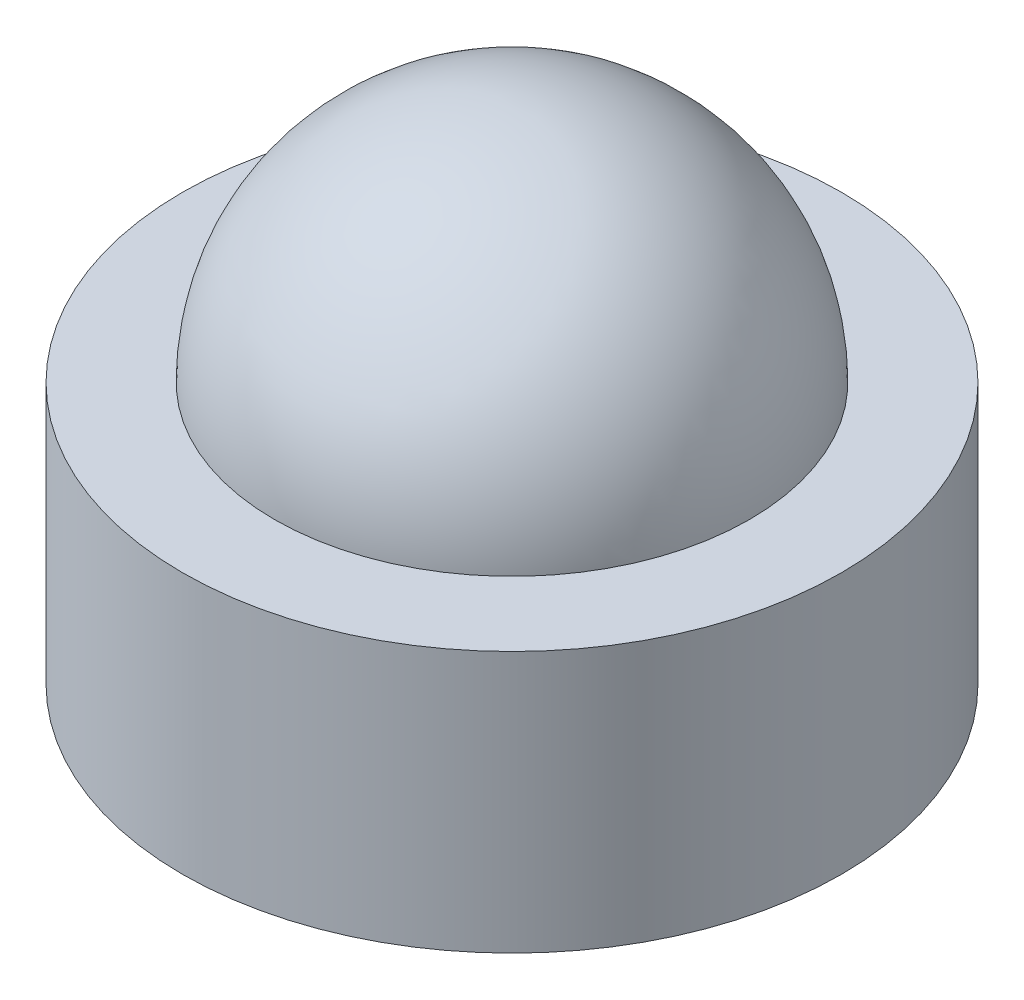
from build123d import *

# Parameters (mm, degrees)
SKETCH1_R           = 55.5
BOSS_EXTRUDE1_DEPTH = 44
SKETCH4_R           = 2
CUT_EXTRUDE1_DEPTH  = 4


with BuildPart() as part:
    # Sketch1 → Boss-Extrude1 (new body)
    with BuildSketch(Plane(origin=(0, 0, 0), x_dir=(1, 0, 0), z_dir=(0, 1, 0))):
        with Locations(Location((0, 0, 0), (0, 0, 270))):
            Circle(SKETCH1_R)
    extrude(amount=BOSS_EXTRUDE1_DEPTH)

    # Sketch3 → Revolve1 (revolve)
    with BuildSketch(Plane.XY):
        with BuildLine():
            Line((0, 44), (-40, 44))
            ThreePointArc((-40, 44), (-28.284271247, 72.284271247), (0, 84))
            Line((0, 84), (0, 44))
        make_face()
    revolve(axis=Axis((0, 44, 0), (0, 1, 0)))

    # Sketch4 → Cut-Extrude1 (cut)
    with BuildSketch(Plane.XZ):
        with Locations(Location((0, 50.2, 0), (0, 0, 270))):
            Circle(SKETCH4_R)
        with Locations(Location((43.47447527, -25.1, 0), (0, 0, 270))):
            Circle(SKETCH4_R)
        with Locations(Location((-43.47447527, -25.1, 0), (0, 0, 270))):
            Circle(SKETCH4_R)
    extrude(amount=-CUT_EXTRUDE1_DEPTH, mode=Mode.SUBTRACT)


solid = part.part
